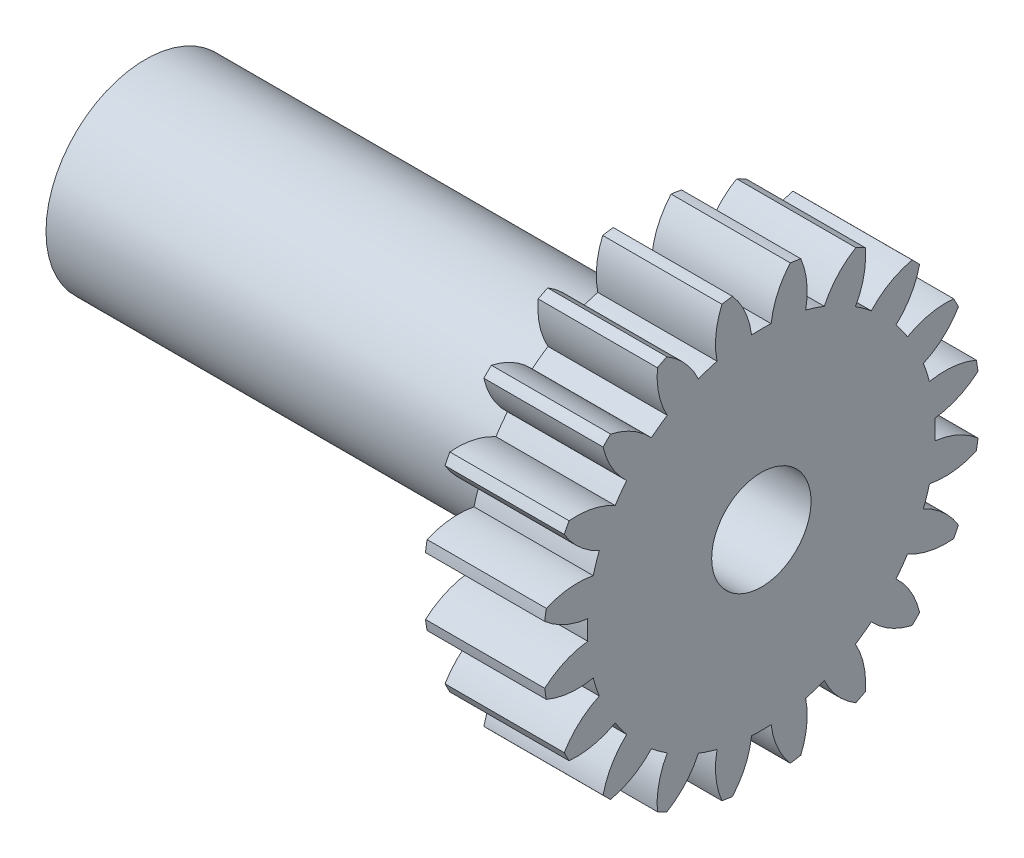
from build123d import *

# Parameters (mm, degrees)
BASPROSKE_W         = 12
BASPROSKE_H         = 22
TOOTHCUT_DEPTH      = 34.346664001
TEETHCUTS_COUNT     = 20
TEETHCUTS_ANGLE     = 342
BORSKE_R            = 5
BORE_DEPTH          = 50.0000508
SKETCH1_R           = 10
SKETCH1_R_2         = 5
BOSS_EXTRUDE1_DEPTH = 50


with BuildPart() as part:
    # BasProSke → Base-Revolve (revolve)
    with BuildSketch(Plane(origin=(0, 0, 0), x_dir=(1, 0, 0), z_dir=(0, 1, 0)), mode=Mode.PRIVATE) as base_revolve_sk:
        with Locations((6, 11)):
            Rectangle(BASPROSKE_W, BASPROSKE_H)
    revolve(base_revolve_sk.sketch.rotate(Axis((-10, 0, 0), (1, 0, 0)), 180), axis=Axis((-10, 0, 0), (1, 0, 0)))

    # TooCutSke → ToothCut (cut, through all)
    with BuildSketch(Plane(origin=(0, 0, 0), x_dir=(0, 0, -1), z_dir=(1, 0, 0))):
        with BuildLine():
            ThreePointArc((0.986171591, 17.471189616), (0, 17.499), (-0.986171591, 17.471189616))
            ThreePointArc((-0.986171591, 17.471189616), (-1.626916196, 19.798789858), (-2.932850173, 21.829260982))
            ThreePointArc((-2.932850173, 21.829260982), (0, 22.0254), (2.932850173, 21.829260982))
            ThreePointArc((2.932850173, 21.829260982), (1.626916196, 19.798789858), (0.986171591, 17.471189616))
        make_face()
    toothcut = extrude(amount=TOOTHCUT_DEPTH, mode=Mode.SUBTRACT)

    # TeethCuts: ToothCut ×20 about axis
    teethcuts_axis = Axis((-10, 0, 0), (1, 0, 0))
    for i in range(1, TEETHCUTS_COUNT):
        add(toothcut.rotate(teethcuts_axis, i * TEETHCUTS_ANGLE / (TEETHCUTS_COUNT - 1)), mode=Mode.SUBTRACT)

    # BorSke → Bore (cut, symmetric)
    with BuildSketch(Plane(origin=(0, 0, 0), x_dir=(0, 0, -1), z_dir=(1, 0, 0))):
        with Locations(Location((0, 0, 0), (0, 0, 180))):
            Circle(BORSKE_R)
    extrude(amount=BORE_DEPTH, both=True, mode=Mode.SUBTRACT)

    # Sketch1 → Boss-Extrude1 (add)
    with BuildSketch(Plane.ZY):
        with Locations(Location((0, 0, 0), (0, 0, 180))):
            Circle(SKETCH1_R)
        Circle(SKETCH1_R_2, mode=Mode.SUBTRACT)
    extrude(amount=BOSS_EXTRUDE1_DEPTH)


solid = part.part
